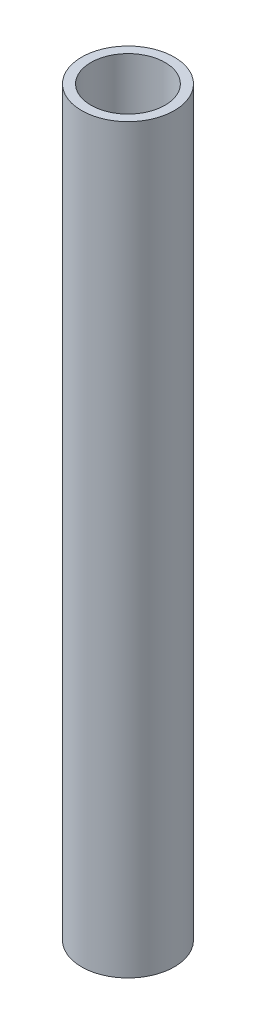
from build123d import *

# Parameters (mm, degrees)
SKETCH1_R           = 15.875
SKETCH1_R_2         = 12.7
BOSS_EXTRUDE1_DEPTH = 127


with BuildPart() as part:
    # Sketch1 → Boss-Extrude1 (new, symmetric)
    with BuildSketch(Plane(origin=(0, 0, 0), x_dir=(1, 0, 0), z_dir=(0, 1, 0))):
        with Locations(Location((0, 0, 0), (0, 0, 270))):
            Circle(SKETCH1_R)
        with Locations(Location((0, 0, 0), (0, 0, 270))):
            Circle(SKETCH1_R_2, mode=Mode.SUBTRACT)
    extrude(amount=BOSS_EXTRUDE1_DEPTH, both=True)


solid = part.part
